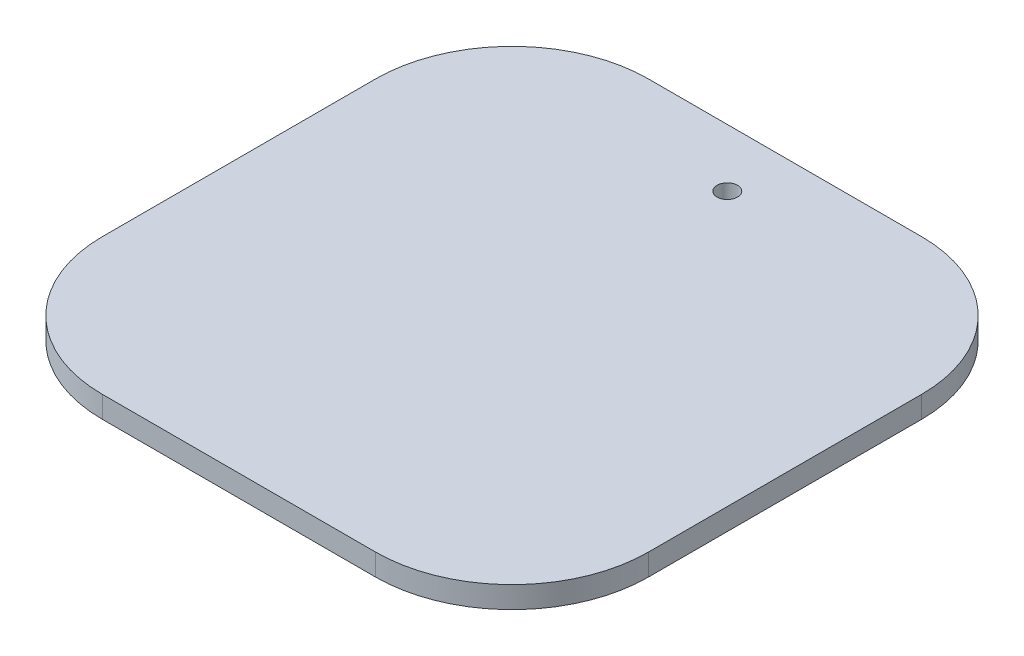
from build123d import *

# Parameters (mm, degrees)
BOSS_EXTRUDE1_DEPTH      = 4.7625
M4_CLEARANCE_HOLE1_D     = 4.5
M4_CLEARANCE_HOLE1_DEPTH = 50
M4_CLEARANCE_HOLE1_TIP   = 1.351936393


with BuildPart() as part:
    # Sketch1 → Boss-Extrude1 (new body)
    with BuildSketch(Plane(origin=(0, 0, 0), x_dir=(1, 0, 0), z_dir=(0, 1, 0))):
        with BuildLine():
            Line((-30, 60), (30, 60))
            ThreePointArc((30, 60), (51.213203436, 51.213203436), (60, 30))
            Line((60, 30), (60, -30))
            ThreePointArc((60, -30), (51.213203436, -51.213203436), (30, -60))
            Line((30, -60), (-30, -60))
            ThreePointArc((-30, -60), (-51.213203436, -51.213203436), (-60, -30))
            Line((-60, -30), (-60, 30))
            ThreePointArc((-60, 30), (-51.213203436, 51.213203436), (-30, 60))
        make_face()
    extrude(amount=BOSS_EXTRUDE1_DEPTH)

    # M4 Clearance Hole1
    with Locations(Plane(origin=(0, 4.7625, 0), x_dir=(1, 0, 0), z_dir=(0, 1, 0))):
        with Locations((0, 47.3)):
            Hole(M4_CLEARANCE_HOLE1_D / 2, depth=M4_CLEARANCE_HOLE1_DEPTH)
            with Locations((0, 0, -(M4_CLEARANCE_HOLE1_DEPTH + M4_CLEARANCE_HOLE1_TIP / 2))):  # 118° drill point
                Cone(0, M4_CLEARANCE_HOLE1_D / 2, M4_CLEARANCE_HOLE1_TIP, mode=Mode.SUBTRACT)


solid = part.part
